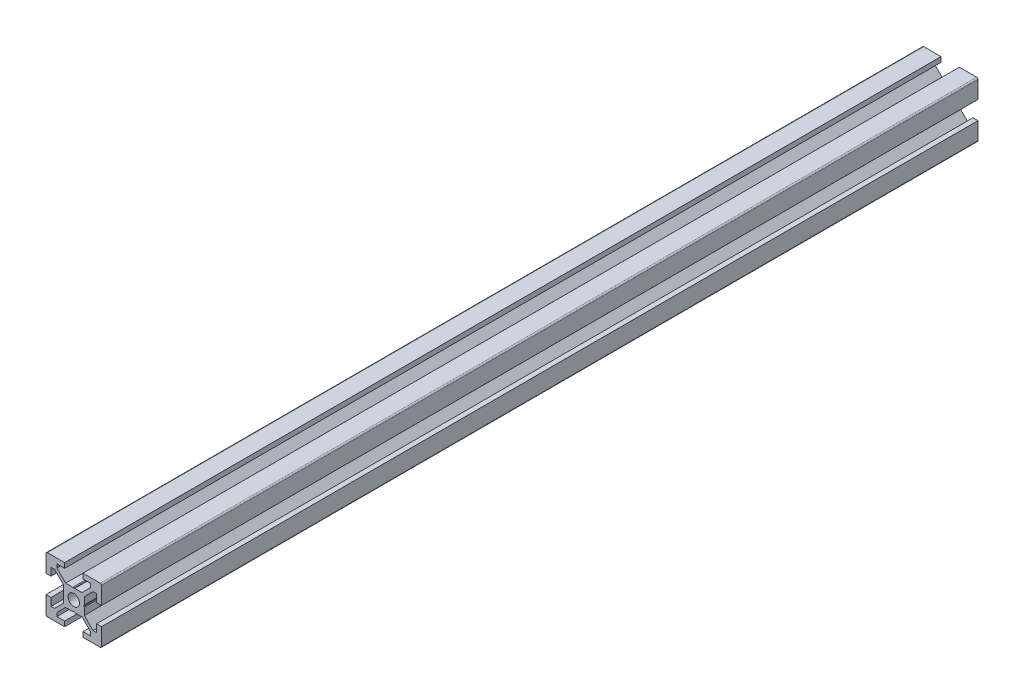
from build123d import *

# Parameters (mm, degrees)
SKETCH1_R           = 2.05
BOSS_EXTRUDE1_DEPTH = 315.25
FILLET1_R           = 0.5


with BuildPart() as part:
    # Sketch1 → Boss-Extrude1 (new body)
    with BuildSketch(Plane.XY):
        Polygon((-3.3, 10), (-3.3, 8.2), (-6.08, 8.2), (-6.08, 6.928528137), (-2.931471863, 3.78), (-0.34, 3.78), (0, 3.66), (0.34, 3.78), (2.931471863, 3.78), (6.08, 6.928528137), (6.08, 8.2), (3.3, 8.2), (3.3, 10), (10, 10), (10, 3.3), (8.2, 3.3), (8.2, 6.08), (6.928528137, 6.08), (3.78, 2.931471863), (3.78, 0.34), (3.66, 0), (3.78, -0.34), (3.78, -2.931471863), (6.928528137, -6.08), (8.2, -6.08), (8.2, -3.3), (10, -3.3), (10, -10), (3.3, -10), (3.3, -8.2), (6.08, -8.2), (6.08, -6.928528137), (2.931471863, -3.78), (0.34, -3.78), (0, -3.66), (-0.34, -3.78), (-2.931471863, -3.78), (-6.08, -6.928528137), (-6.08, -8.2), (-3.3, -8.2), (-3.3, -10), (-10, -10), (-10, -3.3), (-8.2, -3.3), (-8.2, -6.08), (-6.928528137, -6.08), (-3.78, -2.931471863), (-3.78, -0.34), (-3.66, 0), (-3.78, 0.34), (-3.78, 2.931471863), (-6.928528137, 6.08), (-8.2, 6.08), (-8.2, 3.3), (-10, 3.3), (-10, 10), align=None)
        Circle(SKETCH1_R, mode=Mode.SUBTRACT)
    extrude(amount=BOSS_EXTRUDE1_DEPTH)

    # Fillet1
    fillet1_edges = [part.edges().sort_by_distance(p)[0] for p in [
        (10, 10, 157.625),
        (10, -10, 157.625),
        (-10, -10, 157.625),
        (-10, 10, 157.625),
    ]]
    fillet(fillet1_edges, radius=FILLET1_R)


solid = part.part
